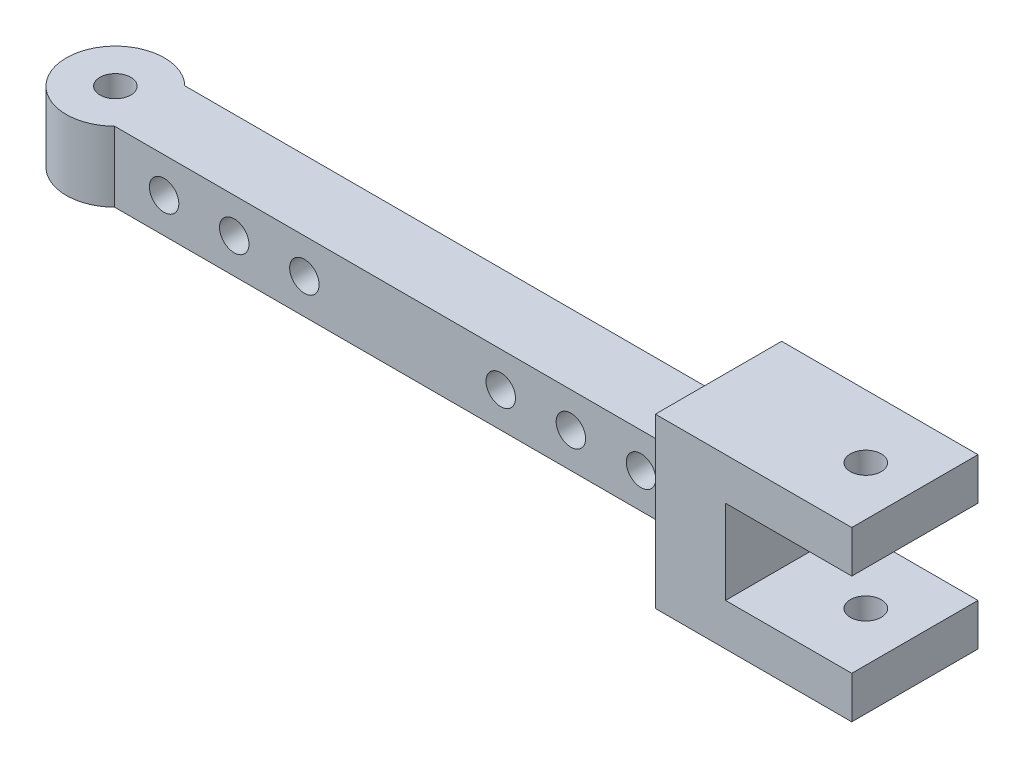
from build123d import *

# Parameters (mm, degrees)
SKETCH1_W           = 50
SKETCH1_H           = 5
BOSS_EXTRUDE1_DEPTH = 5
BOSS_EXTRUDE4_START = 3.5
SKETCH7_W           = 14
SKETCH7_H           = 9
BOSS_EXTRUDE4_DEPTH = 12
CUT_EXTRUDE5_START  = -3
SKETCH9_W           = 9
SKETCH9_H           = 9
CUT_EXTRUDE5_DEPTH  = 6
SKETCH11_R          = 1.1
CUT_EXTRUDE6_DEPTH  = 12
SKETCH16_R          = 3.5
BOSS_EXTRUDE7_DEPTH = 5
SKETCH15_R          = 1.1
CUT_EXTRUDE9_DEPTH  = 5
SKETCH18_R          = 1.05
CUT_EXTRUDE10_DEPTH = 5


with BuildPart() as part:
    # Sketch1 → Boss-Extrude1 (new body)
    with BuildSketch(Plane(origin=(0, 0, 0), x_dir=(1, 0, 0), z_dir=(0, 1, 0))):
        Rectangle(SKETCH1_W, SKETCH1_H)
    extrude(amount=BOSS_EXTRUDE1_DEPTH)

    # Sketch7 → Boss-Extrude4 (add)
    with BuildSketch(Plane(origin=(0, 5, 0), x_dir=(1, 0, 0), z_dir=(0, 1, 0)).offset(BOSS_EXTRUDE4_START)):
        with Locations((25, 0)):
            Rectangle(SKETCH7_W, SKETCH7_H)
    extrude(amount=-BOSS_EXTRUDE4_DEPTH)

    # Sketch9 → Cut-Extrude5 (cut)
    with BuildSketch(Plane(origin=(0, 8.5, 0), x_dir=(1, 0, 0), z_dir=(0, 1, 0)).offset(CUT_EXTRUDE5_START)):
        with Locations((27.5, 0)):
            Rectangle(SKETCH9_W, SKETCH9_H)
    extrude(amount=-CUT_EXTRUDE5_DEPTH, mode=Mode.SUBTRACT)

    # Sketch11 → Cut-Extrude6 (cut)
    with BuildSketch(Plane(origin=(0, 8.5, 0), x_dir=(1, 0, 0), z_dir=(0, 1, 0))):
        with Locations(Location((28.5, 0, 0), (0, 0, 270))):
            Circle(SKETCH11_R)
    extrude(amount=-CUT_EXTRUDE6_DEPTH, mode=Mode.SUBTRACT)

    # Sketch16 → Boss-Extrude7 (add)
    with BuildSketch(Plane(origin=(0, 5, 0), x_dir=(1, 0, 0), z_dir=(0, 1, 0))):
        with Locations((-25, 0)):
            Circle(SKETCH16_R)
    extrude(amount=-BOSS_EXTRUDE7_DEPTH)

    # Sketch15 → Cut-Extrude9 (cut)
    with BuildSketch(Plane(origin=(0, 5, 0), x_dir=(1, 0, 0), z_dir=(0, 1, 0))):
        with Locations(Location((-25, 0, 0), (0, 0, 270))):
            Circle(SKETCH15_R)
    extrude(amount=-CUT_EXTRUDE9_DEPTH, mode=Mode.SUBTRACT)

    # Sketch18 → Cut-Extrude10 (cut)
    with BuildSketch(Plane.XY.offset(2.5)):
        with Locations((-14.025255129, 2.5)):
            Circle(SKETCH18_R)
        with Locations((9.974744871, 2.5)):
            Circle(SKETCH18_R)
        with Locations((-19.025255129, 2.5)):
            Circle(SKETCH18_R)
        with Locations((-9.025255129, 2.5)):
            Circle(SKETCH18_R)
        with Locations((4.974744871, 2.5)):
            Circle(SKETCH18_R)
        with Locations((14.974744871, 2.5)):
            Circle(SKETCH18_R)
    extrude(amount=-CUT_EXTRUDE10_DEPTH, mode=Mode.SUBTRACT)


solid = part.part
